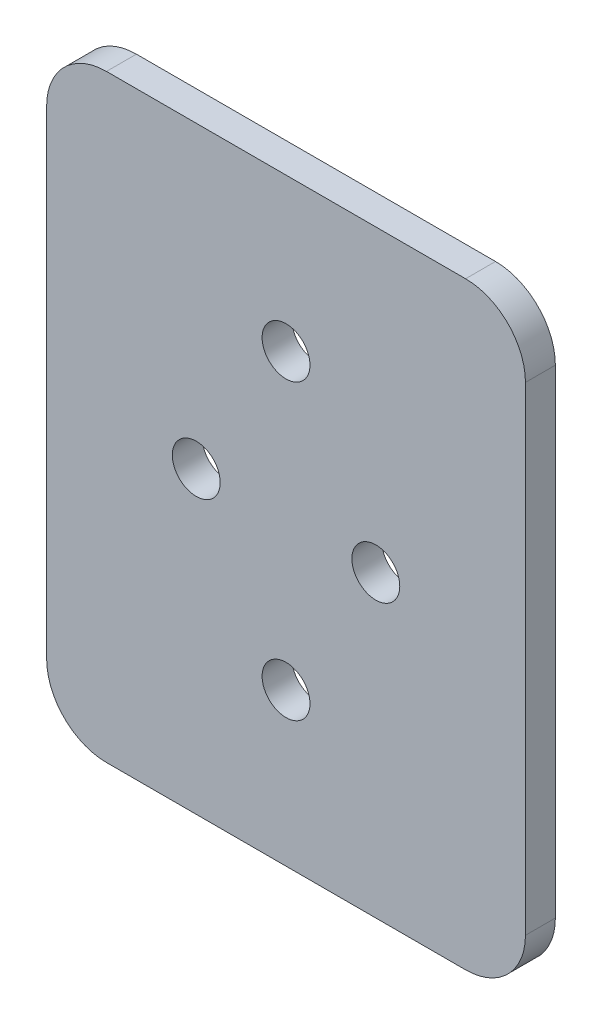
from build123d import *

# Parameters (mm, degrees)
IZIM1_R                     = 4
Y_KSEKLIK_EKSTR_ZYON1_DEPTH = 5


with BuildPart() as part:
    # Çizim1 → Yükseklik-Ekstrüzyon1 (new body)
    with BuildSketch(Plane.XY):
        with BuildLine():
            Line((30, -50), (-30, -50))
            ThreePointArc((-30, -50), (-37.071067812, -47.071067812), (-40, -40))
            Line((-40, -40), (-40, 40))
            ThreePointArc((-40, 40), (-37.071067812, 47.071067812), (-30, 50))
            Line((-30, 50), (30, 50))
            ThreePointArc((30, 50), (37.071067812, 47.071067812), (40, 40))
            Line((40, 40), (40, -40))
            ThreePointArc((40, -40), (37.071067812, -47.071067812), (30, -50))
        make_face()
        with Locations((0, 24.5)):
            Circle(IZIM1_R, mode=Mode.SUBTRACT)
        with Locations((0, -24.5)):
            Circle(IZIM1_R, mode=Mode.SUBTRACT)
        with Locations((-15, 0)):
            Circle(IZIM1_R, mode=Mode.SUBTRACT)
        with Locations((15, 0)):
            Circle(IZIM1_R, mode=Mode.SUBTRACT)
    extrude(amount=Y_KSEKLIK_EKSTR_ZYON1_DEPTH)


solid = part.part
